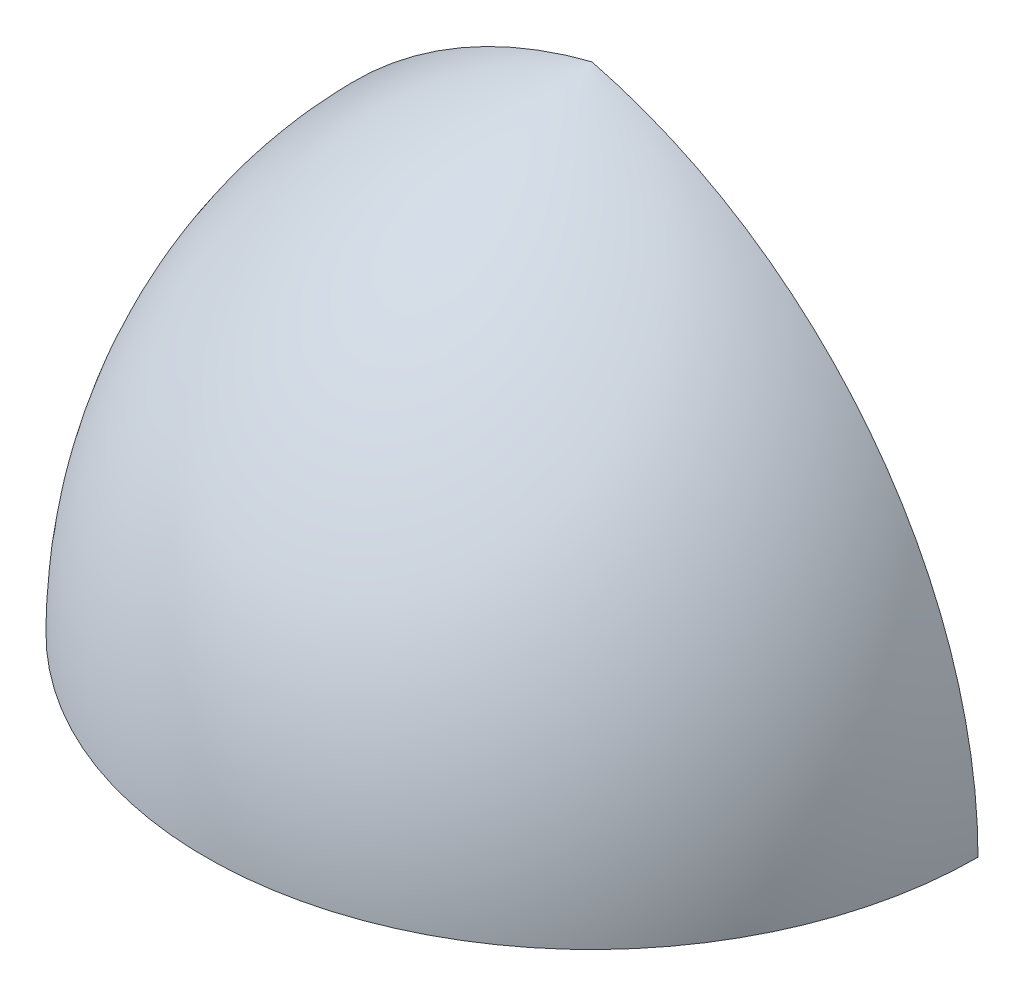
from build123d import *

# Parameters (mm, degrees)
REVOLVE3_ANGLE = 180


with BuildPart() as part:
    # Sketch1 → Revolve3 (revolve)
    with BuildSketch(Plane.XY):
        with BuildLine():
            Line((0, 0), (0, 388.5))
            ThreePointArc((0, 388.5), (-217.956697272, 246.190221171), (-302.5, 0))
            Line((-302.5, 0), (0, 0))
        make_face()
    revolve(axis=Axis((0, 0, 0), (0, 1, 0)), revolution_arc=REVOLVE3_ANGLE)


solid = part.part
